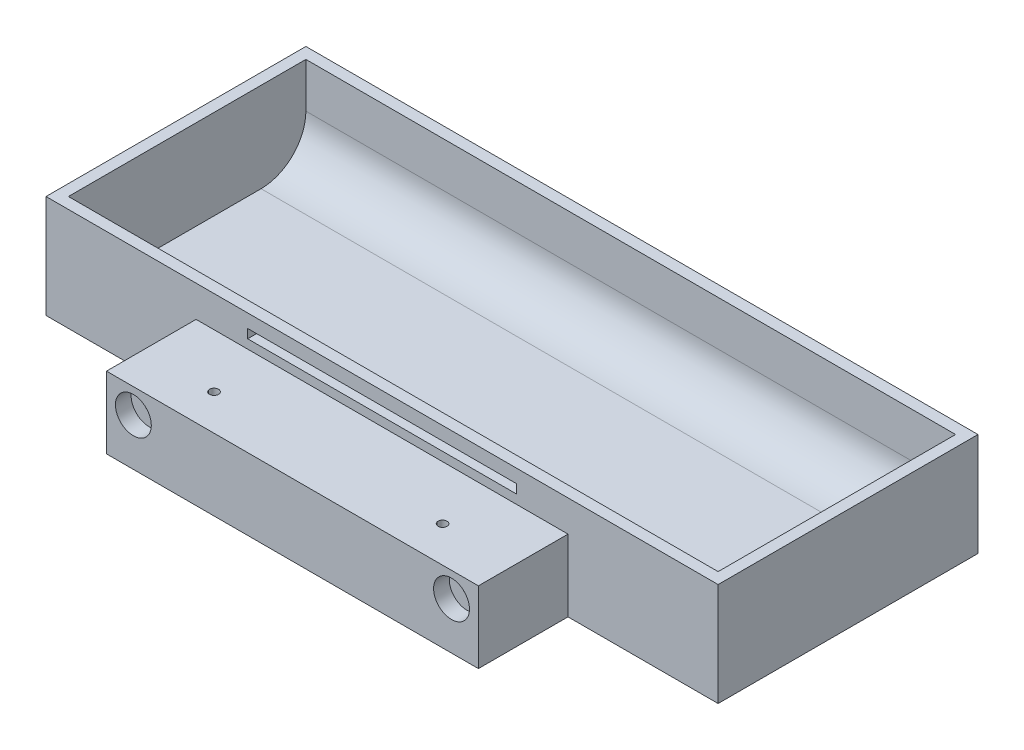
from build123d import *

# Parameters (mm, degrees)
SKETCH_1_W          = 83
SKETCH_1_H          = 20
EXTRUDE_1_DEPTH     = 16
SKETCH_2_R          = 4
CUT_EXTRUDE_1_DEPTH = 3.5
SKETCH_3_R          = 1
CUT_EXTRUDE_2_DEPTH = 10
SKETCH_6_R          = 1
CUT_EXTRUDE_5_DEPTH = 8
SKETCH_7_W          = 150
SKETCH_7_H          = 3
EXTRUDE_2_DEPTH     = 58
SKETCH_8_W          = 150
SKETCH_8_H          = 58
SKETCH_8_W_2        = 145
SKETCH_8_H_2        = 53
EXTRUDE_3_DEPTH     = 20
FILLET_1_R          = 10
CUT_EXTRUDE_START   = -45
SKETCH_9_W          = 2
SKETCH_9_H          = 2
CUT_EXTRUDE_6_DEPTH = 60


with BuildPart() as part:
    # 스케치1 → 보스-돌출1 (new body)
    with BuildSketch(Plane(origin=(0, 0, 0), x_dir=(1, 0, 0), z_dir=(0, 1, 0))):
        Rectangle(SKETCH_1_W, SKETCH_1_H)
    extrude(amount=EXTRUDE_1_DEPTH)

    # 스케치2 → 컷-돌출1 (cut)
    with BuildSketch(Plane.XY.offset(10)):
        with Locations((-35.5, 10.5)):
            Circle(SKETCH_2_R)
        with Locations((35.5, 10.5)):
            Circle(SKETCH_2_R)
    extrude(amount=-CUT_EXTRUDE_1_DEPTH, mode=Mode.SUBTRACT)

    # 스케치3 → 컷-돌출2 (cut)
    with BuildSketch(Plane(origin=(0, 16, 0), x_dir=(1, 0, 0), z_dir=(0, 1, 0))):
        with Locations(Location((-25.5, -2, 0), (0, 0, 270))):
            Circle(SKETCH_3_R)
        with Locations(Location((25.5, -2, 0), (0, 0, 270))):
            Circle(SKETCH_3_R)
    extrude(amount=-CUT_EXTRUDE_2_DEPTH, mode=Mode.SUBTRACT)

    # 스케치6 → 컷-돌출5 (cut)
    with BuildSketch(Plane.XY.offset(6.5)):
        with Locations((-35.5, 10.5)):
            Circle(SKETCH_6_R)
        with Locations((35.5, 10.5)):
            Circle(SKETCH_6_R)
    extrude(amount=-CUT_EXTRUDE_5_DEPTH, mode=Mode.SUBTRACT)

    # 스케치7 → 보스-돌출2 (add)
    with BuildSketch(Plane(origin=(0, 0, -10), x_dir=(-1, 0, 0), z_dir=(0, 0, -1))):
        with Locations((0, 1.5)):
            Rectangle(SKETCH_7_W, SKETCH_7_H)
    extrude(amount=EXTRUDE_2_DEPTH)

    # 스케치8 → 보스-돌출3 (add)
    with BuildSketch(Plane(origin=(0, 3, 0), x_dir=(1, 0, 0), z_dir=(0, 1, 0))):
        with Locations((0, 39)):
            Rectangle(SKETCH_8_W, SKETCH_8_H)
        with Locations((0, 39)):
            Rectangle(SKETCH_8_W_2, SKETCH_8_H_2, mode=Mode.SUBTRACT)
    extrude(amount=EXTRUDE_3_DEPTH)

    # 필렛1
    fillet_1_edges = [part.edges().sort_by_distance(p)[0] for p in [
        (0, 3, -65.5),
        (0, 3, -12.5),
    ]]
    fillet(fillet_1_edges, radius=FILLET_1_R)

    # 스케치9 → 컷-돌출6 (cut)
    with BuildSketch(Plane.ZY.offset(75).offset(CUT_EXTRUDE_START)):
        with Locations((-67, 19)):
            Rectangle(SKETCH_9_W, SKETCH_9_H)
        with Locations((-11, 19)):
            Rectangle(SKETCH_9_W, SKETCH_9_H)
    extrude(amount=-CUT_EXTRUDE_6_DEPTH, mode=Mode.SUBTRACT)


solid = part.part
